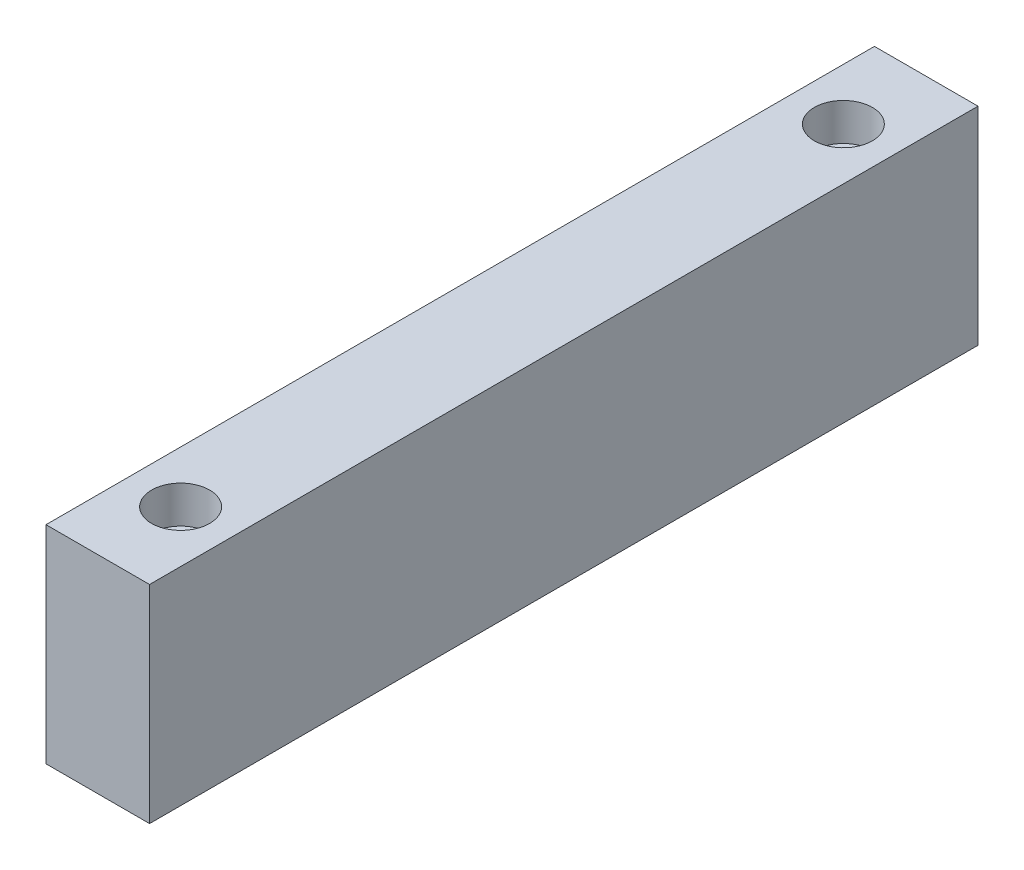
from build123d import *

# Parameters (mm, degrees)
SKETCH1_W                                       = 200
SKETCH1_H                                       = 50
BOSS_EXTRUDE1_DEPTH                             = 25
CBORE_FOR_M8_SOCKET_HEAD_CAP_SCREW1_D           = 9
CBORE_FOR_M8_SOCKET_HEAD_CAP_SCREW1_CBORE_D     = 14
CBORE_FOR_M8_SOCKET_HEAD_CAP_SCREW1_CBORE_DEPTH = 9


with BuildPart() as part:
    # Sketch1 → Boss-Extrude1 (new body)
    with BuildSketch(Plane(origin=(0, 0, 0), x_dir=(0, 0, -1), z_dir=(1, 0, 0))):
        with Locations((0, 25)):
            Rectangle(SKETCH1_W, SKETCH1_H)
    extrude(amount=BOSS_EXTRUDE1_DEPTH)

    # CBORE for M8 Socket Head Cap Screw1 (through all)
    with Locations(Plane(origin=(0, 50, 0), x_dir=(-1, 0, 0), z_dir=(0, 1, 0))):
        with Locations((-12.5, 80), (-12.5, -80)):
            CounterBoreHole(CBORE_FOR_M8_SOCKET_HEAD_CAP_SCREW1_D / 2, CBORE_FOR_M8_SOCKET_HEAD_CAP_SCREW1_CBORE_D / 2, CBORE_FOR_M8_SOCKET_HEAD_CAP_SCREW1_CBORE_DEPTH)


solid = part.part
